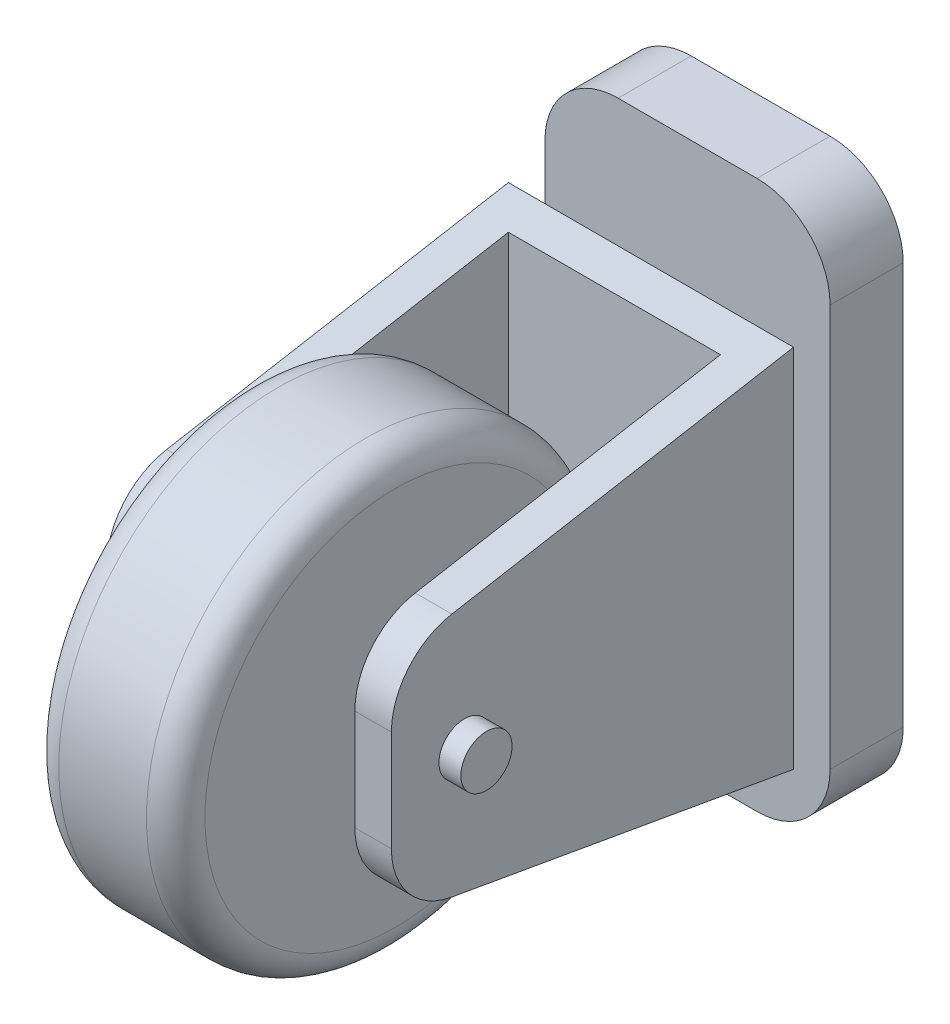
from build123d import *

# Parameters (mm, degrees)
SKETCH1_W           = 39
SKETCH1_H           = 75
BOSS_EXTRUDE1_DEPTH = 10
SKETCH2_R           = 10
BOSS_EXTRUDE2_DEPTH = 5
SKETCH3_W           = 39
SKETCH3_H           = 50
BOSS_EXTRUDE3_DEPTH = 5
SKETCH4_W           = 5
SKETCH4_H           = 50
BOSS_EXTRUDE4_DEPTH = 50
CUT_EXTRUDE1_REACH  = 830.882
FILLET1_R           = 10
SKETCH6_R           = 30
BOSS_EXTRUDE5_DEPTH = 10
SKETCH7_R           = 3.5
BOSS_EXTRUDE6_DEPTH = 22.5
FILLET2_R           = 4
FILLET3_R           = 10


with BuildPart() as part:
    # Sketch1 → Boss-Extrude1 (new body)
    with BuildSketch(Plane.XY):
        with Locations((-295.5, 787.5)):
            Rectangle(SKETCH1_W, SKETCH1_H)
    extrude(amount=BOSS_EXTRUDE1_DEPTH)

    # Sketch2 → Boss-Extrude2 (add)
    with BuildSketch(Plane.XY.offset(10)):
        with Locations(Location((-295.5, 787.5, 0), (0, 0, 180))):
            Circle(SKETCH2_R)
    extrude(amount=BOSS_EXTRUDE2_DEPTH)

    # Sketch3 → Boss-Extrude3 (add)
    with BuildSketch(Plane.XY.offset(15)):
        with Locations((-295.5, 787.5)):
            Rectangle(SKETCH3_W, SKETCH3_H)
    extrude(amount=BOSS_EXTRUDE3_DEPTH)

    # Sketch4 → Boss-Extrude4 (add)
    with BuildSketch(Plane.XY.offset(20)):
        with Locations((-278.5, 787.5)):
            Rectangle(SKETCH4_W, SKETCH4_H)
        with Locations((-312.5, 787.5)):
            Rectangle(SKETCH4_W, SKETCH4_H)
    extrude(amount=BOSS_EXTRUDE4_DEPTH)

    # Cut-Extrude1: up to this face of the body (flat: up to its plane)
    cut_extrude1_end = Plane(part.part.faces().sort_by_distance((-315, 787.5, 42.5))[0])
    # Sketch5 → Cut-Extrude1 (cut, up to the picked face)
    with BuildSketch(Plane(origin=(-276, 0, 0), x_dir=(0, 0, -1), z_dir=(1, 0, 0)), mode=Mode.PRIVATE) as cut_extrude1_sk1:
        Polygon((-15, 812.5), (-70, 802.802016061), (-70, 812.5), align=None)
    cut_extrude1_tool1 = split(extrude(cut_extrude1_sk1.sketch, amount=-CUT_EXTRUDE1_REACH, mode=Mode.PRIVATE), bisect_by=cut_extrude1_end, keep=Keep.BOTH, mode=Mode.PRIVATE)
    # Sketch5 → Cut-Extrude1 (cut, up to the picked face)
    with BuildSketch(Plane(origin=(-276, 0, 0), x_dir=(0, 0, -1), z_dir=(1, 0, 0)), mode=Mode.PRIVATE) as cut_extrude1_sk2:
        Polygon((-70, 762.5), (-15, 762.5), (-70, 772.197983939), align=None)
    cut_extrude1_tool2 = split(extrude(cut_extrude1_sk2.sketch, amount=-CUT_EXTRUDE1_REACH, mode=Mode.PRIVATE), bisect_by=cut_extrude1_end, keep=Keep.BOTH, mode=Mode.PRIVATE)
    add(cut_extrude1_tool1.solids().sort_by(Axis((-276, 809.267339, 51.666667), (-1, 0, 0)))[0], mode=Mode.SUBTRACT)
    add(cut_extrude1_tool2.solids().sort_by(Axis((-276, 765.732661, 51.666667), (-1, 0, 0)))[0], mode=Mode.SUBTRACT)

    # Fillet1
    fillet1_edges = [part.edges().sort_by_distance(p)[0] for p in [
        (-315, 825, 5),
        (-276, 825, 5),
        (-276, 750, 5),
        (-315, 750, 5),
    ]]
    fillet(fillet1_edges, radius=FILLET1_R)



with BuildPart() as body_2:
    # Sketch6 → Boss-Extrude5 (new, symmetric)
    with BuildSketch(Plane(origin=(-295.5, 0, 0), x_dir=(0, 0, -1), z_dir=(1, 0, 0))):
        with Locations((-60, 787.5)):
            Circle(SKETCH6_R)
    extrude(amount=BOSS_EXTRUDE5_DEPTH, both=True)


with BuildPart() as part_1:
    add(part.part)

    add(body_2.part)  # Boss-Extrude6 merges body 2
    # Sketch7 → Boss-Extrude6 (add, symmetric)
    with BuildSketch(Plane(origin=(-295.5, 0, 0), x_dir=(0, 0, -1), z_dir=(1, 0, 0))):
        with Locations(Location((-60, 787.5, 0), (0, 0, 180))):
            Circle(SKETCH7_R)
    extrude(amount=BOSS_EXTRUDE6_DEPTH, both=True)

    # Fillet2
    fillet2_edges = [part_1.edges().sort_by_distance(p)[0] for p in [
        (-305.5, 787.5, 90),
        (-285.5, 787.5, 90),
    ]]
    fillet(fillet2_edges, radius=FILLET2_R)

    # Fillet3
    fillet3_edges = [part_1.edges().sort_by_distance(p)[0] for p in [
        (-278.5, 802.802016061, 70),
        (-312.5, 802.802016061, 70),
        (-278.5, 772.197983939, 70),
        (-312.5, 772.197983939, 70),
    ]]
    fillet(fillet3_edges, radius=FILLET3_R)


solid = part_1.part
